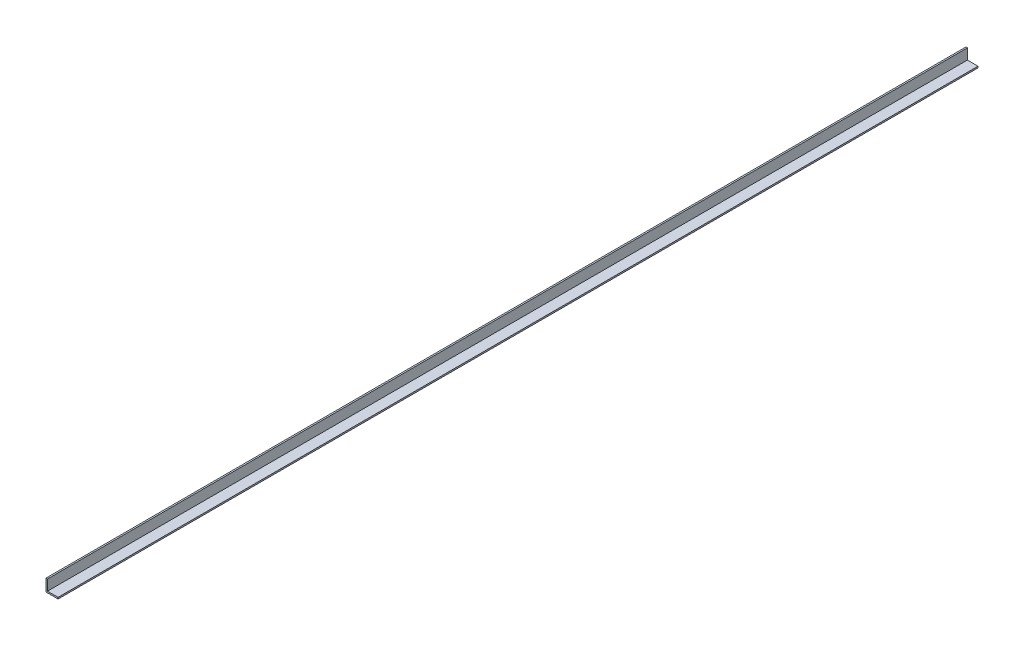
from build123d import *

# Parameters (mm, degrees)
BOSS_EXTRUDE1_DEPTH = 1930.4


with BuildPart() as part:
    # Sketch1 → Boss-Extrude1 (new body)
    with BuildSketch(Plane.XY):
        Polygon((0, 0), (0, 25.4), (3.175, 25.4), (3.175, 3.175), (25.4, 3.175), (25.4, 0), align=None)
    extrude(amount=BOSS_EXTRUDE1_DEPTH)


solid = part.part
